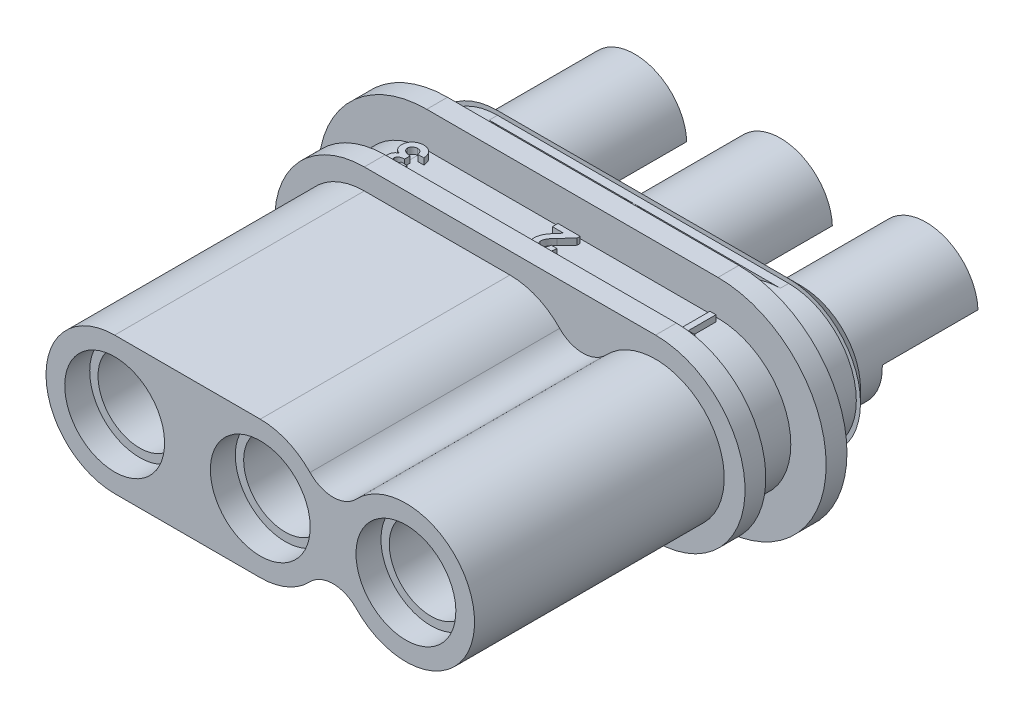
from build123d import *
from build123d.topology import SkipClean

# Parameters (mm, degrees)
BOSS_EXTRUDE1_DEPTH      = 6
CUT_EXTRUDE7_DEPTH       = 9.077437713
BOSS_EXTRUDE14_DEPTH     = 0.5
BOSS_EXTRUDE15_DEPTH     = 1
BOSS_EXTRUDE16_DEPTH     = 0.5
BOSS_EXTRUDE17_DEPTH     = 1.5
CHAMFER2_SIZE            = 0.3
CUT_EXTRUDE9_DEPTH       = 1.2
CUT_EXTRUDE11_DEPTH      = 1
MIRROR5_COPY_1_DEPTH     = 1
LPATTERN4_COUNT          = 3
LPATTERN4_PITCH          = 3.5
CUT_EXTRUDE10_DEPTH      = 10.285472524
CUT_EXTRUDE10_DEPTH_BACK = 10.285472524
SKETCH33_W               = 2.3
SKETCH33_H               = 1.3
LPATTERN5_COUNT          = 3
LPATTERN5_PITCH          = 3.5
BOSS_EXTRUDE18_DEPTH     = 0.3
BOSS_EXTRUDE19_DEPTH     = 0.3


with BuildPart() as part:
    # Sketch1 → Boss-Extrude1 (new body)
    with BuildSketch(Plane.XY):
        with BuildLine():
            Line((-3.5, 1.65), (3.5, 1.65))
            ThreePointArc((3.5, 1.65), (5.15, 0), (3.5, -1.65))
            Line((3.5, -1.65), (-3.5, -1.65))
            ThreePointArc((-3.5, -1.65), (-5.15, 0), (-3.5, 1.65))
        make_face()
    extrude(amount=BOSS_EXTRUDE1_DEPTH)

    # Sketch3 → Cut-Extrude7 (cut, through all)
    with SkipClean():  # the faces are left unmerged after this step: merging them gives an invalid solid
        with BuildSketch(Plane.XY.offset(6)):
            with BuildLine():
                Line((3.5, 1.65), (0, 1.65))
                ThreePointArc((0, 1.65), (0.649966843, 1.5165893), (1.194827586, 1.137931034))
                ThreePointArc((1.194827586, 1.137931034), (1.75, 0.9), (2.305172414, 1.137931034))
                ThreePointArc((2.305172414, 1.137931034), (2.850033157, 1.5165893), (3.5, 1.65))
            make_face()
            with BuildLine():
                Line((3.5, -1.65), (0, -1.65))
                ThreePointArc((0, -1.65), (0.649966843, -1.5165893), (1.194827586, -1.137931034))
                ThreePointArc((1.194827586, -1.137931034), (1.75, -0.9), (2.305172414, -1.137931034))
                ThreePointArc((2.305172414, -1.137931034), (2.850033157, -1.5165893), (3.5, -1.65))
            make_face()
        extrude(amount=-CUT_EXTRUDE7_DEPTH, mode=Mode.SUBTRACT)

    # Sketch25 → Boss-Extrude14 (add)
    with SkipClean():  # the faces are left unmerged after this step: merging them gives an invalid solid
        with BuildSketch(Plane(origin=(0, 0, 0), x_dir=(-1, 0, 0), z_dir=(0, 0, -1))):
            with BuildLine():
                Line((-3.5, 2.15), (3.5, 2.15))
                ThreePointArc((3.5, 2.15), (5.65, 0), (3.5, -2.15))
                Line((3.5, -2.15), (-3.5, -2.15))
                ThreePointArc((-3.5, -2.15), (-5.65, 0), (-3.5, 2.15))
            make_face()
        extrude(amount=BOSS_EXTRUDE14_DEPTH)

    # Sketch26 → Boss-Extrude15 (add)
    with SkipClean():  # the faces are left unmerged after this step: merging them gives an invalid solid
        with BuildSketch(Plane(origin=(0, 0, -0.5), x_dir=(-1, 0, 0), z_dir=(0, 0, -1))):
            with BuildLine():
                Line((-3.5, 1.75), (3.5, 1.75))
                ThreePointArc((3.5, 1.75), (5.25, 0), (3.5, -1.75))
                Line((3.5, -1.75), (-3.5, -1.75))
                ThreePointArc((-3.5, -1.75), (-5.25, 0), (-3.5, 1.75))
            make_face()
        extrude(amount=BOSS_EXTRUDE15_DEPTH)

    # Sketch27 → Boss-Extrude16 (add)
    with SkipClean():  # the faces are left unmerged after this step: merging them gives an invalid solid
        with BuildSketch(Plane(origin=(0, 0, -1.5), x_dir=(-1, 0, 0), z_dir=(0, 0, -1))):
            with BuildLine():
                Line((-3.5, 2.6), (3.5, 2.6))
                ThreePointArc((3.5, 2.6), (6.1, 0), (3.5, -2.6))
                Line((3.5, -2.6), (-3.5, -2.6))
                ThreePointArc((-3.5, -2.6), (-6.1, 0), (-3.5, 2.6))
            make_face()
        extrude(amount=BOSS_EXTRUDE16_DEPTH)

    # Sketch28 → Boss-Extrude17 (add)
    with SkipClean():  # the faces are left unmerged after this step: merging them gives an invalid solid
        with BuildSketch(Plane(origin=(0, 0, -2), x_dir=(-1, 0, 0), z_dir=(0, 0, -1))):
            with BuildLine():
                Line((-3.5, 1.725), (3.5, 1.725))
                ThreePointArc((3.5, 1.725), (5.225, 0), (3.5, -1.725))
                Line((3.5, -1.725), (-3.5, -1.725))
                ThreePointArc((-3.5, -1.725), (-5.225, 0), (-3.5, 1.725))
            make_face()
        extrude(amount=BOSS_EXTRUDE17_DEPTH)

    # Chamfer2
    chamfer2_edges = [part.edges().sort_by_distance(p)[0] for p in [
        (5.225, 0, -3.5),
        (0, -1.725, -3.5),
        (-5.225, 0, -3.5),
        (0, 1.725, -3.5),
    ]]
    chamfer(chamfer2_edges, length=CHAMFER2_SIZE)

    # Sketch29 → Cut-Extrude9 (cut)
    with SkipClean():  # the faces are left unmerged after this step: merging them gives an invalid solid
        with BuildSketch(Plane(origin=(0, 0, -2), x_dir=(-1, 0, 0), z_dir=(0, 0, -1))):
            with BuildLine():
                Line((3.5, 1.725), (-3.5, 1.725))
                ThreePointArc((-3.5, 1.725), (-5.225, 0), (-3.5, -1.725))
                Line((-3.5, -1.725), (3.5, -1.725))
                ThreePointArc((3.5, -1.725), (5.225, 0), (3.5, 1.725))
            make_face()
            with BuildLine():
                Line((3.5, 1.625), (-3.5, 1.625))
                ThreePointArc((-3.5, 1.625), (-5.125, 0), (-3.5, -1.625))
                Line((-3.5, -1.625), (3.5, -1.625))
                ThreePointArc((3.5, -1.625), (5.125, 0), (3.5, 1.625))
            make_face(mode=Mode.SUBTRACT)
        extrude(amount=CUT_EXTRUDE9_DEPTH, mode=Mode.SUBTRACT)

    # Sketch35 → Cut-Extrude11 (cut)
    with SkipClean():  # the faces are left unmerged after this step: merging them gives an invalid solid
        with BuildSketch(Plane(origin=(0, 0, -2), x_dir=(-1, 0, 0), z_dir=(0, 0, -1))):
            with BuildLine():
                Line((3.5, 1.625), (3.5, 2.6))
                Line((3.5, 2.6), (0, 2.6))
                Line((0, 2.6), (0, 1.625))
                ThreePointArc((0, 1.625), (0.692931252, 1.46985417), (1.253548172, 1.034041576))
                ThreePointArc((1.253548172, 1.034041576), (1.75, 0.8), (2.246451828, 1.034041576))
                ThreePointArc((2.246451828, 1.034041576), (2.807068748, 1.46985417), (3.5, 1.625))
            make_face()
        cut_extrude11 = extrude(amount=CUT_EXTRUDE11_DEPTH, mode=Mode.SUBTRACT)

    # Mirror4: Cut-Extrude11 across plane
    with SkipClean():  # the faces are left unmerged after this step: merging them gives an invalid solid
        add(cut_extrude11.mirror(Plane(origin=(0, 0, 0), x_dir=(0, 0, 1), z_dir=(1, 0, 0))), mode=Mode.SUBTRACT)

    # Mirror5: Cut-Extrude11 across plane
    with SkipClean():  # the faces are left unmerged after this step: merging them gives an invalid solid
        add(cut_extrude11.mirror(Plane.ZX), mode=Mode.SUBTRACT)

    # Mirror5 copy 1 sketch → Mirror5 copy 1 (cut)
    with SkipClean():  # the faces are left unmerged after this step: merging them gives an invalid solid
        with BuildSketch(Plane(origin=(0, 0, -2), x_dir=(1, 0, 0), z_dir=(0, 0, -1))):
            with BuildLine():
                Line((3.5, 1.625), (3.5, 2.6))
                Line((3.5, 2.6), (0, 2.6))
                Line((0, 2.6), (0, 1.625))
                ThreePointArc((0, 1.625), (0.692931252, 1.46985417), (1.253548172, 1.034041576))
                ThreePointArc((1.253548172, 1.034041576), (1.75, 0.8), (2.246451828, 1.034041576))
                ThreePointArc((2.246451828, 1.034041576), (2.807068748, 1.46985417), (3.5, 1.625))
            make_face()
        extrude(amount=MIRROR5_COPY_1_DEPTH, mode=Mode.SUBTRACT)

    # Sketch31 → Cut-Revolve1 (revolve, cut)
    with SkipClean():  # the faces are left unmerged after this step: merging them gives an invalid solid
        with BuildSketch(Plane(origin=(3.5, 0, 0), x_dir=(0, 0, -1), z_dir=(1, 0, 0)), mode=Mode.PRIVATE) as cut_revolve1_sk:
            Polygon((-6, 0), (-6, 1.2), (0.5, 1.2), (0.5, 1.25), (3.5, 1.25), (3.5, 0), align=None)
        cut_revolve1 = revolve(cut_revolve1_sk.sketch.rotate(Axis((3.5, 0, 6), (0, 0, -1)), 180), axis=Axis((3.5, 0, 6), (0, 0, -1)), mode=Mode.SUBTRACT)

    # LPattern4: Cut-Revolve1 ×3
    with SkipClean():  # the faces are left unmerged after this step: merging them gives an invalid solid
        with Locations(*[(-i * LPATTERN4_PITCH, 0, 0) for i in range(1, LPATTERN4_COUNT)]):
            add(cut_revolve1, mode=Mode.SUBTRACT)

    # Sketch38 → Boss-Extrude18 (add)
    with SkipClean():  # the faces are left unmerged after this step: merging them gives an invalid solid
        with BuildSketch(Plane(origin=(0, 1.9, 0), x_dir=(1, 0, 0), z_dir=(0, 1, 0))):
            Polygon((3.629647436, 0.6), (3.407692308, 0.6), (3.407692308, 1.4), (3.551282051, 1.4), (3.551282051, 0.733333333), (3.715384615, 0.733333333), align=None)
            with BuildLine():
                Line((0.123076923, 0.866666667), (0.266666667, 0.866666667))
                add(Edge.make_bspline(
                    [(0.266666667, 0.866666667), (0.266046768, 0.855804749), (0.264835523, 0.834581213), (0.260012214, 0.803755254), (0.253565751, 0.774620985), (0.244888653, 0.747265996), (0.234200861, 0.721678794), (0.221236367, 0.697944135), (0.206382245, 0.675891949), (0.189339082, 0.655908987), (0.170798578, 0.637943697), (0.150808265, 0.622237969), (0.129424927, 0.609090221), (0.10679155, 0.598305063), (0.082997035, 0.589675548), (0.057800973, 0.583909056), (0.031425685, 0.580003086), (0.013369504, 0.579661353), (0.004166667, 0.579487179)],
                    knots=[0, 0, 0, 0, 1.198928049, 2.342633425, 3.435730849, 4.486331048, 5.502589352, 6.488331875, 7.46361919, 8.428949135, 9.378681775, 10.305958057, 11.226249248, 12.140413166, 13.066341608, 14.010670971, 14.986082777, 16, 16, 16, 16], degree=3))
                add(Edge.make_bspline(
                    [(0.004166667, 0.579487179), (-0.00713451, 0.579816538), (-0.029206749, 0.580459807), (-0.061177039, 0.586653296), (-0.091225249, 0.596193698), (-0.119054441, 0.60991552), (-0.144518759, 0.627297778), (-0.167315487, 0.648245635), (-0.187549249, 0.672502137), (-0.204553009, 0.699889992), (-0.218383227, 0.728992028), (-0.22836896, 0.758908731), (-0.234854856, 0.789036897), (-0.235551403, 0.809316467), (-0.235897436, 0.819391026)],
                    knots=[0, 0, 0, 0, 1.075206757, 2.099977874, 3.089436832, 4.070080219, 5.043757236, 6.01602434, 7.009399377, 8.042659726, 9.078134622, 10.07077983, 11.041594984, 12, 12, 12, 12], degree=3))
                add(Edge.make_bspline(
                    [(-0.235897436, 0.819391026), (-0.235763219, 0.825485184), (-0.235493074, 0.837751219), (-0.23361472, 0.85631274), (-0.230796817, 0.87521982), (-0.226548105, 0.894456247), (-0.221249619, 0.914027416), (-0.214821768, 0.933991881), (-0.20711555, 0.954236517), (-0.198259186, 0.974988912), (-0.187694797, 0.99631749), (-0.175388785, 1.018537648), (-0.161001588, 1.041710528), (-0.144673668, 1.065763984), (-0.126520041, 1.090884558), (-0.106264392, 1.116774734), (-0.084166144, 1.14372681), (-0.068477229, 1.161739256), (-0.060416667, 1.17099359)],
                    knots=[0, 0, 0, 0, 0.728286467, 1.465860763, 2.227952348, 3.011875114, 3.818782069, 4.650637576, 5.517456182, 6.406927181, 7.346324104, 8.360844784, 9.441645378, 10.605053135, 11.834886952, 13.145197974, 14.533275831, 16, 16, 16, 16], degree=3))
                Line((-0.060416667, 1.17099359), (0.023076923, 1.266666667))
                Line((0.023076923, 1.266666667), (-0.246153846, 1.266666667))
                Line((-0.246153846, 1.266666667), (-0.246153846, 1.4))
                Line((-0.246153846, 1.4), (0.287179487, 1.4))
                Line((0.287179487, 1.4), (0.287179487, 1.32724359))
                Line((0.287179487, 1.32724359), (0.050320513, 1.075160256))
                add(Edge.make_bspline(
                    [(0.050320513, 1.075160256), (0.043462728, 1.06780698), (0.030181233, 1.053565866), (0.011284798, 1.032650078), (-0.005821099, 1.01280578), (-0.020753974, 0.993802842), (-0.034417307, 0.97628468), (-0.045847691, 0.959589039), (-0.055802154, 0.944186098), (-0.066200643, 0.925410527), (-0.07630305, 0.903186446), (-0.085566796, 0.877599219), (-0.091157085, 0.853126573), (-0.091934663, 0.837151121), (-0.092307692, 0.829487179)],
                    knots=[0, 0, 0, 0, 1.246192343, 2.413505005, 3.49357156, 4.492416076, 5.408771964, 6.246246772, 6.999304986, 7.680960093, 8.904522682, 10.020616941, 11.0504258, 12, 12, 12, 12], degree=3))
                add(Edge.make_bspline(
                    [(-0.092307692, 0.829487179), (-0.092033867, 0.822070436), (-0.091503287, 0.807699307), (-0.085527303, 0.787315926), (-0.076585755, 0.768720806), (-0.063604322, 0.752761006), (-0.047936064, 0.739531817), (-0.029726945, 0.729837626), (-0.009311298, 0.724139891), (0.004985166, 0.723437999), (0.012339744, 0.723076923)],
                    knots=[0, 0, 0, 0, 1.061596218, 2.057012874, 3.024113775, 4.006148568, 4.986025304, 5.949989669, 6.945406325, 8, 8, 8, 8], degree=3))
                add(Edge.make_bspline(
                    [(0.012339744, 0.723076923), (0.016138463, 0.723211282), (0.023616852, 0.723475789), (0.034609499, 0.72523654), (0.045069793, 0.728339679), (0.055114162, 0.73249745), (0.06463541, 0.738008604), (0.073609521, 0.74480198), (0.08213105, 0.752704942), (0.090160913, 0.761692779), (0.097469136, 0.771723208), (0.103960273, 0.78270462), (0.109327363, 0.794630201), (0.114052744, 0.807342514), (0.117697184, 0.820978099), (0.120350788, 0.835455349), (0.122368146, 0.850750712), (0.122836366, 0.861264835), (0.123076923, 0.866666667)],
                    knots=[0, 0, 0, 0, 0.903469896, 1.778625579, 2.63899355, 3.493148037, 4.358286772, 5.247621495, 6.164656832, 7.118446693, 8.109501108, 9.111810964, 10.146451449, 11.215617525, 12.33435995, 13.498009769, 14.714554818, 16, 16, 16, 16], degree=3))
            make_face()
            with BuildLine():
                Line((-3.407692308, 0.794871795), (-3.264102564, 0.794871795))
                add(Edge.make_bspline(
                    [(-3.264102564, 0.794871795), (-3.265110038, 0.787692685), (-3.267077884, 0.773670107), (-3.27191539, 0.753320344), (-3.277509672, 0.73396922), (-3.284663968, 0.715720587), (-3.292922312, 0.698594117), (-3.302552662, 0.682574484), (-3.313108163, 0.667431794), (-3.321372461, 0.658357249), (-3.325480769, 0.653846154)],
                    knots=[0, 0, 0, 0, 1.1115466, 2.171125598, 3.205689823, 4.19946166, 5.17440286, 6.118867946, 7.064860634, 8, 8, 8, 8], degree=3))
                add(Edge.make_bspline(
                    [(-3.325480769, 0.653846154), (-3.331391845, 0.647884889), (-3.343041954, 0.636135864), (-3.362510653, 0.621086659), (-3.382917445, 0.608062597), (-3.404671597, 0.597737025), (-3.427434599, 0.589379672), (-3.451387468, 0.583766018), (-3.476432326, 0.58004131), (-3.493522291, 0.579674413), (-3.50224359, 0.579487179)],
                    knots=[0, 0, 0, 0, 1.01925491, 2.00884431, 2.983262333, 3.955970413, 4.92937149, 5.924503185, 6.940838805, 8, 8, 8, 8], degree=3))
                add(Edge.make_bspline(
                    [(-3.50224359, 0.579487179), (-3.509997273, 0.579670229), (-3.525239452, 0.580030067), (-3.54764162, 0.582918651), (-3.569000212, 0.587984905), (-3.589540995, 0.59460892), (-3.608961881, 0.603621998), (-3.627691508, 0.614084264), (-3.645206569, 0.626916668), (-3.661548047, 0.641415992), (-3.676560811, 0.657098432), (-3.68956193, 0.673861669), (-3.700739225, 0.691257921), (-3.709947838, 0.709431716), (-3.717028011, 0.728413808), (-3.72194186, 0.748094539), (-3.725158094, 0.768430481), (-3.725478515, 0.782252548), (-3.725641026, 0.789262821)],
                    knots=[0, 0, 0, 0, 1.091422571, 2.145516843, 3.172569842, 4.178562979, 5.178154469, 6.181868002, 7.194278174, 8.227918432, 9.254613415, 10.245994977, 11.209837596, 12.161663635, 13.10878368, 14.055455738, 15.013766427, 16, 16, 16, 16], degree=3))
                add(Edge.make_bspline(
                    [(-3.725641026, 0.789262821), (-3.725301122, 0.797942918), (-3.724629907, 0.815083709), (-3.719321582, 0.840121172), (-3.710788146, 0.86400708), (-3.698654865, 0.886458422), (-3.683418114, 0.907451808), (-3.664733127, 0.926254035), (-3.643121327, 0.943156287), (-3.626897512, 0.952239674), (-3.618589744, 0.956891026)],
                    knots=[0, 0, 0, 0, 0.992776698, 1.96045919, 2.915875678, 3.886951799, 4.871409521, 5.874469288, 6.911574252, 8, 8, 8, 8], degree=3))
                add(Edge.make_bspline(
                    [(-3.618589744, 0.956891026), (-3.624292282, 0.95876298), (-3.635497514, 0.962441288), (-3.651421192, 0.969690146), (-3.666575254, 0.977595115), (-3.680613131, 0.98682332), (-3.693919779, 0.996735132), (-3.706074192, 1.007863481), (-3.717391107, 1.019922719), (-3.727590556, 1.033041134), (-3.736709336, 1.047000613), (-3.744745628, 1.061550257), (-3.751489587, 1.076743241), (-3.757149758, 1.092467918), (-3.761468312, 1.108879044), (-3.764506571, 1.125921006), (-3.766263332, 1.143552739), (-3.766531215, 1.15549831), (-3.766666667, 1.161538462)],
                    knots=[0, 0, 0, 0, 1.059375415, 2.081625174, 3.086260357, 4.075579879, 5.045586876, 6.014170127, 6.982201689, 7.963705737, 8.945119069, 9.924852636, 10.896327119, 11.878239286, 12.873838556, 13.889973282, 14.933087432, 16, 16, 16, 16], degree=3))
                add(Edge.make_bspline(
                    [(-3.766666667, 1.161538462), (-3.766415585, 1.170418926), (-3.765920292, 1.187936833), (-3.762139581, 1.213654894), (-3.756067127, 1.238306774), (-3.747535492, 1.261923544), (-3.736364904, 1.284434281), (-3.722873121, 1.305990358), (-3.706895308, 1.326422392), (-3.688673719, 1.345549362), (-3.668607444, 1.363102462), (-3.646991124, 1.378595763), (-3.623811188, 1.391371324), (-3.599620552, 1.402290041), (-3.573876266, 1.410393698), (-3.546910808, 1.416328048), (-3.518527417, 1.419938703), (-3.499155961, 1.420318735), (-3.489262821, 1.420512821)],
                    knots=[0, 0, 0, 0, 1.005301618, 1.9830924, 2.936709333, 3.876255674, 4.820386332, 5.77704884, 6.75110905, 7.752325838, 8.764085485, 9.766124222, 10.757295257, 11.756573224, 12.766631673, 13.80722022, 14.880131728, 16, 16, 16, 16], degree=3))
                add(Edge.make_bspline(
                    [(-3.489262821, 1.420512821), (-3.47990384, 1.420308711), (-3.461603591, 1.419909602), (-3.434836164, 1.416453481), (-3.4093943, 1.410882333), (-3.385222195, 1.403015976), (-3.362422759, 1.392881034), (-3.340863165, 1.38064799), (-3.320778775, 1.365942023), (-3.302077124, 1.349110101), (-3.284916761, 1.330485787), (-3.269960833, 1.309917271), (-3.256945234, 1.287853995), (-3.245784062, 1.26424851), (-3.237063597, 1.238890193), (-3.230128443, 1.212005501), (-3.225300187, 1.183478185), (-3.223827688, 1.163852473), (-3.223076923, 1.153846154)],
                    knots=[0, 0, 0, 0, 1.066693477, 2.085777942, 3.071407889, 4.032495163, 4.978645371, 5.911608997, 6.853298848, 7.810770565, 8.776420673, 9.735131334, 10.704462168, 11.693492242, 12.70668109, 13.756973703, 14.856375978, 16, 16, 16, 16], degree=3))
                Line((-3.223076923, 1.153846154), (-3.366666667, 1.153846154))
                add(Edge.make_bspline(
                    [(-3.366666667, 1.153846154), (-3.367576757, 1.158877451), (-3.369349398, 1.168677223), (-3.372803698, 1.182866509), (-3.377316971, 1.195958941), (-3.382476982, 1.208050709), (-3.38818198, 1.219265904), (-3.394998463, 1.229304614), (-3.402307246, 1.238561359), (-3.413294012, 1.249201364), (-3.428623067, 1.260359659), (-3.449377705, 1.270241956), (-3.472570598, 1.27586239), (-3.488751847, 1.276561652), (-3.497115385, 1.276923077)],
                    knots=[0, 0, 0, 0, 0.928450228, 1.808400301, 2.64896863, 3.43999153, 4.194978884, 4.9294959, 5.640047715, 6.332896648, 7.70085756, 9.063442004, 10.482192841, 12, 12, 12, 12], degree=3))
                add(Edge.make_bspline(
                    [(-3.497115385, 1.276923077), (-3.501554056, 1.276846697), (-3.510248421, 1.276697087), (-3.523021245, 1.27504823), (-3.535181139, 1.272312985), (-3.54685512, 1.268641539), (-3.557883958, 1.263800065), (-3.568408651, 1.258042591), (-3.578241926, 1.251043346), (-3.587414758, 1.243150693), (-3.595716249, 1.234459495), (-3.603224491, 1.225380966), (-3.609250591, 1.215544148), (-3.614252745, 1.205338059), (-3.61837892, 1.194765335), (-3.620967673, 1.183585416), (-3.622905828, 1.172022385), (-3.623019322, 1.164111229), (-3.623076923, 1.160096154)],
                    knots=[0, 0, 0, 0, 1.110416125, 2.175056767, 3.216269732, 4.226816172, 5.232753079, 6.226173397, 7.223992381, 8.247806573, 9.250094092, 10.229378924, 11.190237183, 12.128982156, 13.072570213, 14.022671385, 14.996464856, 16, 16, 16, 16], degree=3))
                add(Edge.make_bspline(
                    [(-3.623076923, 1.160096154), (-3.62293067, 1.155703491), (-3.622641263, 1.14701125), (-3.620094498, 1.134273186), (-3.616282366, 1.121972746), (-3.610799812, 1.110211417), (-3.603625646, 1.099058371), (-3.594902596, 1.088421236), (-3.584551752, 1.078384702), (-3.572919734, 1.068656464), (-3.559537212, 1.06014041), (-3.544944592, 1.052298399), (-3.528782374, 1.046054224), (-3.511438291, 1.040478382), (-3.492586234, 1.036405534), (-3.472342699, 1.033448348), (-3.450740506, 1.031247152), (-3.435849827, 1.030931356), (-3.428205128, 1.030769231)],
                    knots=[0, 0, 0, 0, 0.809868251, 1.602574917, 2.388262527, 3.182133002, 3.988875265, 4.829537611, 5.714850619, 6.646378958, 7.622533229, 8.636771727, 9.698525113, 10.814716514, 11.996253919, 13.252421425, 14.589425562, 16, 16, 16, 16], degree=3))
                Line((-3.428205128, 1.030769231), (-3.428205128, 0.897435897))
                add(Edge.make_bspline(
                    [(-3.428205128, 0.897435897), (-3.437724188, 0.89662759), (-3.455532462, 0.895115408), (-3.480237317, 0.891541593), (-3.501146182, 0.886868989), (-3.518483817, 0.88088338), (-3.533095555, 0.873858931), (-3.545535092, 0.865525082), (-3.556609378, 0.856297296), (-3.565650741, 0.84569821), (-3.572956996, 0.834509718), (-3.578130362, 0.822762631), (-3.581564502, 0.810718096), (-3.581889998, 0.802479613), (-3.582051282, 0.798397436)],
                    knots=[0, 0, 0, 0, 1.700278244, 3.18088388, 4.44026007, 5.507838349, 6.439172496, 7.317391478, 8.167251366, 8.996486918, 9.787781501, 10.536992524, 11.275078289, 12, 12, 12, 12], degree=3))
                add(Edge.make_bspline(
                    [(-3.582051282, 0.798397436), (-3.581779439, 0.793185696), (-3.58124886, 0.783013483), (-3.576936579, 0.768490819), (-3.569930338, 0.755330384), (-3.560065735, 0.743985882), (-3.54799617, 0.734619235), (-3.533935683, 0.727792187), (-3.518122667, 0.723708571), (-3.507022724, 0.723292241), (-3.501282051, 0.723076923)],
                    knots=[0, 0, 0, 0, 1.008776249, 1.968917671, 2.909425455, 3.878736958, 4.86052431, 5.85160606, 6.888892716, 8, 8, 8, 8], degree=3))
                add(Edge.make_bspline(
                    [(-3.501282051, 0.723076923), (-3.49607903, 0.723332439), (-3.485754643, 0.723839461), (-3.470663393, 0.727640582), (-3.456348242, 0.733974611), (-3.443176315, 0.742869387), (-3.431180006, 0.753441906), (-3.421121344, 0.765862082), (-3.412932971, 0.779644117), (-3.409446044, 0.789776003), (-3.407692308, 0.794871795)],
                    knots=[0, 0, 0, 0, 0.988439209, 1.961366134, 2.938893463, 3.950078543, 4.971412263, 5.967491143, 6.977757845, 8, 8, 8, 8], degree=3))
            make_face()
        extrude(amount=-BOSS_EXTRUDE18_DEPTH)

    # Sketch39 → Boss-Extrude19 (add)
    with SkipClean():  # the faces are left unmerged after this step: merging them gives an invalid solid
        with BuildSketch(Plane(origin=(0, -1.9, 0), x_dir=(-1, 0, 0), z_dir=(0, -1, 0))):
            with BuildLine():
                Line((3.592307692, 0.794871795), (3.735897436, 0.794871795))
                add(Edge.make_bspline(
                    [(3.735897436, 0.794871795), (3.734889962, 0.787692685), (3.732922116, 0.773670107), (3.72808461, 0.753320344), (3.722490328, 0.73396922), (3.715336032, 0.715720587), (3.707077688, 0.698594117), (3.697447338, 0.682574484), (3.686891837, 0.667431794), (3.678627539, 0.658357249), (3.674519231, 0.653846154)],
                    knots=[0, 0, 0, 0, 1.1115466, 2.171125598, 3.205689823, 4.19946166, 5.17440286, 6.118867946, 7.064860634, 8, 8, 8, 8], degree=3))
                add(Edge.make_bspline(
                    [(3.674519231, 0.653846154), (3.668608155, 0.647884889), (3.656958046, 0.636135864), (3.637489347, 0.621086659), (3.617082555, 0.608062597), (3.595328403, 0.597737025), (3.572565401, 0.589379672), (3.548612532, 0.583766018), (3.523567674, 0.58004131), (3.506477709, 0.579674413), (3.49775641, 0.579487179)],
                    knots=[0, 0, 0, 0, 1.01925491, 2.00884431, 2.983262333, 3.955970413, 4.92937149, 5.924503185, 6.940838805, 8, 8, 8, 8], degree=3))
                add(Edge.make_bspline(
                    [(3.49775641, 0.579487179), (3.490002727, 0.579670229), (3.474760548, 0.580030067), (3.45235838, 0.582918651), (3.430999788, 0.587984905), (3.410459005, 0.59460892), (3.391038119, 0.603621998), (3.372308492, 0.614084264), (3.354793431, 0.626916668), (3.338451953, 0.641415992), (3.323439189, 0.657098432), (3.31043807, 0.673861669), (3.299260775, 0.691257921), (3.290052162, 0.709431716), (3.282971989, 0.728413808), (3.27805814, 0.748094539), (3.274841906, 0.768430481), (3.274521485, 0.782252548), (3.274358974, 0.789262821)],
                    knots=[0, 0, 0, 0, 1.091422571, 2.145516843, 3.172569842, 4.178562979, 5.178154469, 6.181868002, 7.194278174, 8.227918432, 9.254613415, 10.245994977, 11.209837596, 12.161663635, 13.10878368, 14.055455738, 15.013766427, 16, 16, 16, 16], degree=3))
                add(Edge.make_bspline(
                    [(3.274358974, 0.789262821), (3.274698878, 0.797942918), (3.275370093, 0.815083709), (3.280678418, 0.840121172), (3.289211854, 0.86400708), (3.301345135, 0.886458422), (3.316581886, 0.907451808), (3.335266873, 0.926254035), (3.356878673, 0.943156287), (3.373102488, 0.952239674), (3.381410256, 0.956891026)],
                    knots=[0, 0, 0, 0, 0.992776698, 1.96045919, 2.915875678, 3.886951799, 4.871409521, 5.874469288, 6.911574252, 8, 8, 8, 8], degree=3))
                add(Edge.make_bspline(
                    [(3.381410256, 0.956891026), (3.375707718, 0.95876298), (3.364502486, 0.962441288), (3.348578808, 0.969690146), (3.333424746, 0.977595115), (3.319386869, 0.98682332), (3.306080221, 0.996735132), (3.293925808, 1.007863481), (3.282608893, 1.019922719), (3.272409444, 1.033041134), (3.263290664, 1.047000613), (3.255254372, 1.061550257), (3.248510413, 1.076743241), (3.242850242, 1.092467918), (3.238531688, 1.108879044), (3.235493429, 1.125921006), (3.233736668, 1.143552739), (3.233468785, 1.15549831), (3.233333333, 1.161538462)],
                    knots=[0, 0, 0, 0, 1.059375415, 2.081625174, 3.086260357, 4.075579879, 5.045586876, 6.014170127, 6.982201689, 7.963705737, 8.945119069, 9.924852636, 10.896327119, 11.878239286, 12.873838556, 13.889973282, 14.933087432, 16, 16, 16, 16], degree=3))
                add(Edge.make_bspline(
                    [(3.233333333, 1.161538462), (3.233584415, 1.170418926), (3.234079708, 1.187936833), (3.237860419, 1.213654894), (3.243932873, 1.238306774), (3.252464508, 1.261923544), (3.263635096, 1.284434281), (3.277126879, 1.305990358), (3.293104692, 1.326422392), (3.311326281, 1.345549362), (3.331392556, 1.363102462), (3.353008876, 1.378595763), (3.376188812, 1.391371324), (3.400379448, 1.402290041), (3.426123734, 1.410393698), (3.453089192, 1.416328048), (3.481472583, 1.419938703), (3.500844039, 1.420318735), (3.510737179, 1.420512821)],
                    knots=[0, 0, 0, 0, 1.005301618, 1.9830924, 2.936709333, 3.876255674, 4.820386332, 5.77704884, 6.75110905, 7.752325838, 8.764085485, 9.766124222, 10.757295257, 11.756573224, 12.766631673, 13.80722022, 14.880131728, 16, 16, 16, 16], degree=3))
                add(Edge.make_bspline(
                    [(3.510737179, 1.420512821), (3.52009616, 1.420308711), (3.538396409, 1.419909602), (3.565163836, 1.416453481), (3.5906057, 1.410882333), (3.614777805, 1.403015976), (3.637577241, 1.392881034), (3.659136835, 1.38064799), (3.679221225, 1.365942023), (3.697922876, 1.349110101), (3.715083239, 1.330485787), (3.730039167, 1.309917271), (3.743054766, 1.287853995), (3.754215938, 1.26424851), (3.762936403, 1.238890193), (3.769871557, 1.212005501), (3.774699813, 1.183478185), (3.776172312, 1.163852473), (3.776923077, 1.153846154)],
                    knots=[0, 0, 0, 0, 1.066693477, 2.085777942, 3.071407889, 4.032495163, 4.978645371, 5.911608997, 6.853298848, 7.810770565, 8.776420673, 9.735131334, 10.704462168, 11.693492242, 12.70668109, 13.756973703, 14.856375978, 16, 16, 16, 16], degree=3))
                Line((3.776923077, 1.153846154), (3.633333333, 1.153846154))
                add(Edge.make_bspline(
                    [(3.633333333, 1.153846154), (3.632423243, 1.158877451), (3.630650602, 1.168677223), (3.627196302, 1.182866509), (3.622683029, 1.195958941), (3.617523018, 1.208050709), (3.61181802, 1.219265904), (3.605001537, 1.229304614), (3.597692754, 1.238561359), (3.586705988, 1.249201364), (3.571376933, 1.260359659), (3.550622295, 1.270241956), (3.527429402, 1.27586239), (3.511248153, 1.276561652), (3.502884615, 1.276923077)],
                    knots=[0, 0, 0, 0, 0.928450228, 1.808400301, 2.64896863, 3.43999153, 4.194978884, 4.9294959, 5.640047715, 6.332896648, 7.70085756, 9.063442004, 10.482192841, 12, 12, 12, 12], degree=3))
                add(Edge.make_bspline(
                    [(3.502884615, 1.276923077), (3.498445944, 1.276846697), (3.489751579, 1.276697087), (3.476978755, 1.27504823), (3.464818861, 1.272312985), (3.45314488, 1.268641539), (3.442116042, 1.263800065), (3.431591349, 1.258042591), (3.421758074, 1.251043346), (3.412585242, 1.243150693), (3.404283751, 1.234459495), (3.396775509, 1.225380966), (3.390749409, 1.215544148), (3.385747255, 1.205338059), (3.38162108, 1.194765335), (3.379032327, 1.183585416), (3.377094172, 1.172022385), (3.376980678, 1.164111229), (3.376923077, 1.160096154)],
                    knots=[0, 0, 0, 0, 1.110416125, 2.175056767, 3.216269732, 4.226816172, 5.232753079, 6.226173397, 7.223992381, 8.247806573, 9.250094092, 10.229378924, 11.190237183, 12.128982156, 13.072570213, 14.022671385, 14.996464856, 16, 16, 16, 16], degree=3))
                add(Edge.make_bspline(
                    [(3.376923077, 1.160096154), (3.37706933, 1.155703491), (3.377358737, 1.14701125), (3.379905502, 1.134273186), (3.383717634, 1.121972746), (3.389200188, 1.110211417), (3.396374354, 1.099058371), (3.405097404, 1.088421236), (3.415448248, 1.078384702), (3.427080266, 1.068656464), (3.440462788, 1.06014041), (3.455055408, 1.052298399), (3.471217626, 1.046054224), (3.488561709, 1.040478382), (3.507413766, 1.036405534), (3.527657301, 1.033448348), (3.549259494, 1.031247152), (3.564150173, 1.030931356), (3.571794872, 1.030769231)],
                    knots=[0, 0, 0, 0, 0.809868251, 1.602574917, 2.388262527, 3.182133002, 3.988875265, 4.829537611, 5.714850619, 6.646378958, 7.622533229, 8.636771727, 9.698525113, 10.814716514, 11.996253919, 13.252421425, 14.589425562, 16, 16, 16, 16], degree=3))
                Line((3.571794872, 1.030769231), (3.571794872, 0.897435897))
                add(Edge.make_bspline(
                    [(3.571794872, 0.897435897), (3.562275812, 0.89662759), (3.544467538, 0.895115408), (3.519762683, 0.891541593), (3.498853818, 0.886868989), (3.481516183, 0.88088338), (3.466904445, 0.873858931), (3.454464908, 0.865525082), (3.443390622, 0.856297296), (3.434349259, 0.84569821), (3.427043004, 0.834509718), (3.421869638, 0.822762631), (3.418435498, 0.810718096), (3.418110002, 0.802479613), (3.417948718, 0.798397436)],
                    knots=[0, 0, 0, 0, 1.700278244, 3.18088388, 4.44026007, 5.507838349, 6.439172496, 7.317391478, 8.167251366, 8.996486918, 9.787781501, 10.536992524, 11.275078289, 12, 12, 12, 12], degree=3))
                add(Edge.make_bspline(
                    [(3.417948718, 0.798397436), (3.418220561, 0.793185696), (3.41875114, 0.783013483), (3.423063421, 0.768490819), (3.430069662, 0.755330384), (3.439934265, 0.743985882), (3.45200383, 0.734619235), (3.466064317, 0.727792187), (3.481877333, 0.723708571), (3.492977276, 0.723292241), (3.498717949, 0.723076923)],
                    knots=[0, 0, 0, 0, 1.008776249, 1.968917671, 2.909425455, 3.878736958, 4.86052431, 5.85160606, 6.888892716, 8, 8, 8, 8], degree=3))
                add(Edge.make_bspline(
                    [(3.498717949, 0.723076923), (3.50392097, 0.723332439), (3.514245357, 0.723839461), (3.529336607, 0.727640582), (3.543651758, 0.733974611), (3.556823685, 0.742869387), (3.568819994, 0.753441906), (3.578878656, 0.765862082), (3.587067029, 0.779644117), (3.590553956, 0.789776003), (3.592307692, 0.794871795)],
                    knots=[0, 0, 0, 0, 0.988439209, 1.961366134, 2.938893463, 3.950078543, 4.971412263, 5.967491143, 6.977757845, 8, 8, 8, 8], degree=3))
            make_face()
            with BuildLine():
                Line((0.123076923, 0.866666667), (0.266666667, 0.866666667))
                add(Edge.make_bspline(
                    [(0.266666667, 0.866666667), (0.266046768, 0.855804749), (0.264835523, 0.834581213), (0.260012214, 0.803755254), (0.253565751, 0.774620985), (0.244888653, 0.747265996), (0.234200861, 0.721678794), (0.221236367, 0.697944135), (0.206382245, 0.675891949), (0.189339082, 0.655908987), (0.170798578, 0.637943697), (0.150808265, 0.622237969), (0.129424927, 0.609090221), (0.10679155, 0.598305063), (0.082997035, 0.589675548), (0.057800973, 0.583909056), (0.031425685, 0.580003086), (0.013369504, 0.579661353), (0.004166667, 0.579487179)],
                    knots=[0, 0, 0, 0, 1.198928049, 2.342633425, 3.435730849, 4.486331048, 5.502589352, 6.488331875, 7.46361919, 8.428949135, 9.378681775, 10.305958057, 11.226249248, 12.140413166, 13.066341608, 14.010670971, 14.986082777, 16, 16, 16, 16], degree=3))
                add(Edge.make_bspline(
                    [(0.004166667, 0.579487179), (-0.00713451, 0.579816538), (-0.029206749, 0.580459807), (-0.061177039, 0.586653296), (-0.091225249, 0.596193698), (-0.119054441, 0.60991552), (-0.144518759, 0.627297778), (-0.167315487, 0.648245635), (-0.187549249, 0.672502137), (-0.204553009, 0.699889992), (-0.218383227, 0.728992028), (-0.22836896, 0.758908731), (-0.234854856, 0.789036897), (-0.235551403, 0.809316467), (-0.235897436, 0.819391026)],
                    knots=[0, 0, 0, 0, 1.075206757, 2.099977874, 3.089436832, 4.070080219, 5.043757236, 6.01602434, 7.009399377, 8.042659726, 9.078134622, 10.07077983, 11.041594984, 12, 12, 12, 12], degree=3))
                add(Edge.make_bspline(
                    [(-0.235897436, 0.819391026), (-0.235763219, 0.825485184), (-0.235493074, 0.837751219), (-0.23361472, 0.85631274), (-0.230796817, 0.87521982), (-0.226548105, 0.894456247), (-0.221249619, 0.914027416), (-0.214821768, 0.933991881), (-0.20711555, 0.954236517), (-0.198259186, 0.974988912), (-0.187694797, 0.99631749), (-0.175388785, 1.018537648), (-0.161001588, 1.041710528), (-0.144673668, 1.065763984), (-0.126520041, 1.090884558), (-0.106264392, 1.116774734), (-0.084166144, 1.14372681), (-0.068477229, 1.161739256), (-0.060416667, 1.17099359)],
                    knots=[0, 0, 0, 0, 0.728286467, 1.465860763, 2.227952348, 3.011875114, 3.818782069, 4.650637576, 5.517456182, 6.406927181, 7.346324104, 8.360844784, 9.441645378, 10.605053135, 11.834886952, 13.145197974, 14.533275831, 16, 16, 16, 16], degree=3))
                Line((-0.060416667, 1.17099359), (0.023076923, 1.266666667))
                Line((0.023076923, 1.266666667), (-0.246153846, 1.266666667))
                Line((-0.246153846, 1.266666667), (-0.246153846, 1.4))
                Line((-0.246153846, 1.4), (0.287179487, 1.4))
                Line((0.287179487, 1.4), (0.287179487, 1.32724359))
                Line((0.287179487, 1.32724359), (0.050320513, 1.075160256))
                add(Edge.make_bspline(
                    [(0.050320513, 1.075160256), (0.043462728, 1.06780698), (0.030181233, 1.053565866), (0.011284798, 1.032650078), (-0.005821099, 1.01280578), (-0.020753974, 0.993802842), (-0.034417307, 0.97628468), (-0.045847691, 0.959589039), (-0.055802154, 0.944186098), (-0.066200643, 0.925410527), (-0.07630305, 0.903186446), (-0.085566796, 0.877599219), (-0.091157085, 0.853126573), (-0.091934663, 0.837151121), (-0.092307692, 0.829487179)],
                    knots=[0, 0, 0, 0, 1.246192343, 2.413505005, 3.49357156, 4.492416076, 5.408771964, 6.246246772, 6.999304986, 7.680960093, 8.904522682, 10.020616941, 11.0504258, 12, 12, 12, 12], degree=3))
                add(Edge.make_bspline(
                    [(-0.092307692, 0.829487179), (-0.092033867, 0.822070436), (-0.091503287, 0.807699307), (-0.085527303, 0.787315926), (-0.076585755, 0.768720806), (-0.063604322, 0.752761006), (-0.047936064, 0.739531817), (-0.029726945, 0.729837626), (-0.009311298, 0.724139891), (0.004985166, 0.723437999), (0.012339744, 0.723076923)],
                    knots=[0, 0, 0, 0, 1.061596218, 2.057012874, 3.024113775, 4.006148568, 4.986025304, 5.949989669, 6.945406325, 8, 8, 8, 8], degree=3))
                add(Edge.make_bspline(
                    [(0.012339744, 0.723076923), (0.016138463, 0.723211282), (0.023616852, 0.723475789), (0.034609499, 0.72523654), (0.045069793, 0.728339679), (0.055114162, 0.73249745), (0.06463541, 0.738008604), (0.073609521, 0.74480198), (0.08213105, 0.752704942), (0.090160913, 0.761692779), (0.097469136, 0.771723208), (0.103960273, 0.78270462), (0.109327363, 0.794630201), (0.114052744, 0.807342514), (0.117697184, 0.820978099), (0.120350788, 0.835455349), (0.122368146, 0.850750712), (0.122836366, 0.861264835), (0.123076923, 0.866666667)],
                    knots=[0, 0, 0, 0, 0.903469896, 1.778625579, 2.63899355, 3.493148037, 4.358286772, 5.247621495, 6.164656832, 7.118446693, 8.109501108, 9.111810964, 10.146451449, 11.215617525, 12.33435995, 13.498009769, 14.714554818, 16, 16, 16, 16], degree=3))
            make_face()
            Polygon((-3.370352564, 0.6), (-3.592307692, 0.6), (-3.592307692, 1.4), (-3.448717949, 1.4), (-3.448717949, 0.733333333), (-3.284615385, 0.733333333), align=None)
        extrude(amount=-BOSS_EXTRUDE19_DEPTH)


with BuildPart() as body_2:
    # Sketch32 → Revolve1 (revolve)
    with BuildSketch(Plane(origin=(3.5, 0, 0), x_dir=(0, 0, -1), z_dir=(1, 0, 0)), mode=Mode.PRIVATE) as revolve1_sk:
        Polygon((-5.4, 1.2), (-5.4, 1), (1.1, 1), (1.700860619, 0), (2.379397567, 0), (2.8, 0.7), (6.5, 0.7), (6.5, 1.25), (0.5, 1.25), (0.5, 1.2), align=None)
    revolve(revolve1_sk.sketch.rotate(Axis((3.5, 0, 0), (0, 0, 1)), 90), axis=Axis((3.5, 0, 0), (0, 0, 1)))

    # Sketch33 → Cut-Extrude10 (cut, two sides: drawn at the far end of the back side and taken through both)
    with BuildSketch(Plane(origin=(0, 0, 0), x_dir=(0, 0, -1), z_dir=(1, 0, 0)).offset(-CUT_EXTRUDE10_DEPTH_BACK)):
        with Locations((5.35, -0.6)):
            Rectangle(SKETCH33_W, SKETCH33_H)
    extrude(amount=CUT_EXTRUDE10_DEPTH + CUT_EXTRUDE10_DEPTH_BACK, mode=Mode.SUBTRACT)


with BuildPart() as lpattern5_1:
    # LPattern5: pattern copy
    add(body_2.part.moved(Location(Vector(-1, 0, 0) * (1 * LPATTERN5_PITCH))))


with BuildPart() as lpattern5_2:
    # LPattern5: pattern copy
    add(body_2.part.moved(Location(Vector(-1, 0, 0) * (2 * LPATTERN5_PITCH))))


solid = Compound([part.part, body_2.part, lpattern5_1.part, lpattern5_2.part])
